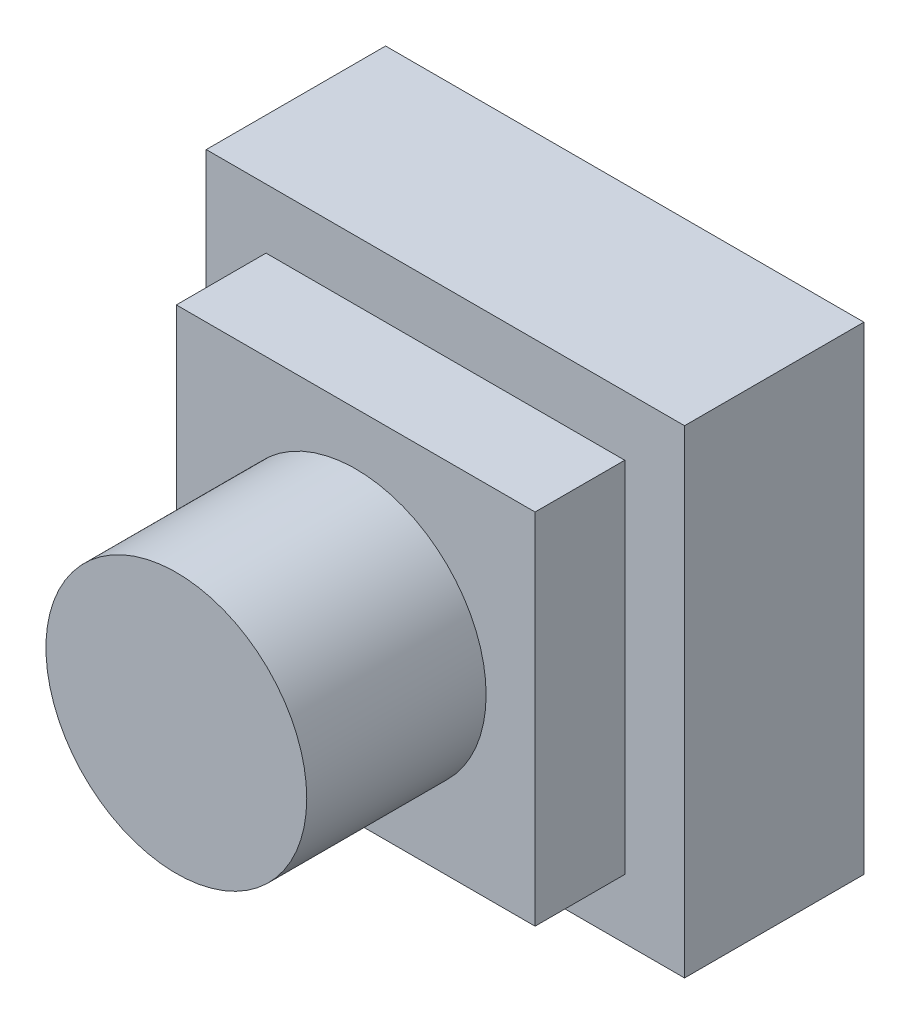
from build123d import *

# Parameters (mm, degrees)
SKETCH1_W           = 6
SKETCH1_H           = 6
BOSS_EXTRUDE1_DEPTH = 1.5
SKETCH2_R           = 2.181214146
BOSS_EXTRUDE2_DEPTH = 3
SKETCH4_W           = 8
SKETCH4_H           = 8
BOSS_EXTRUDE3_DEPTH = 3


with BuildPart() as part:
    # Sketch1 → Boss-Extrude1 (new body)
    with BuildSketch(Plane.XY):
        with Locations((3, 3)):
            Rectangle(SKETCH1_W, SKETCH1_H)
    extrude(amount=-BOSS_EXTRUDE1_DEPTH)

    # Sketch2 → Boss-Extrude2 (add)
    with BuildSketch(Plane.XY):
        with Locations((3, 2.94366618)):
            Circle(SKETCH2_R)
    extrude(amount=BOSS_EXTRUDE2_DEPTH)

    # Sketch4 → Boss-Extrude3 (add)
    with BuildSketch(Plane(origin=(0, 0, -1.5), x_dir=(-1, 0, 0), z_dir=(0, 0, -1))):
        with Locations((-3, 3)):
            Rectangle(SKETCH4_W, SKETCH4_H)
    extrude(amount=BOSS_EXTRUDE3_DEPTH)


solid = part.part
